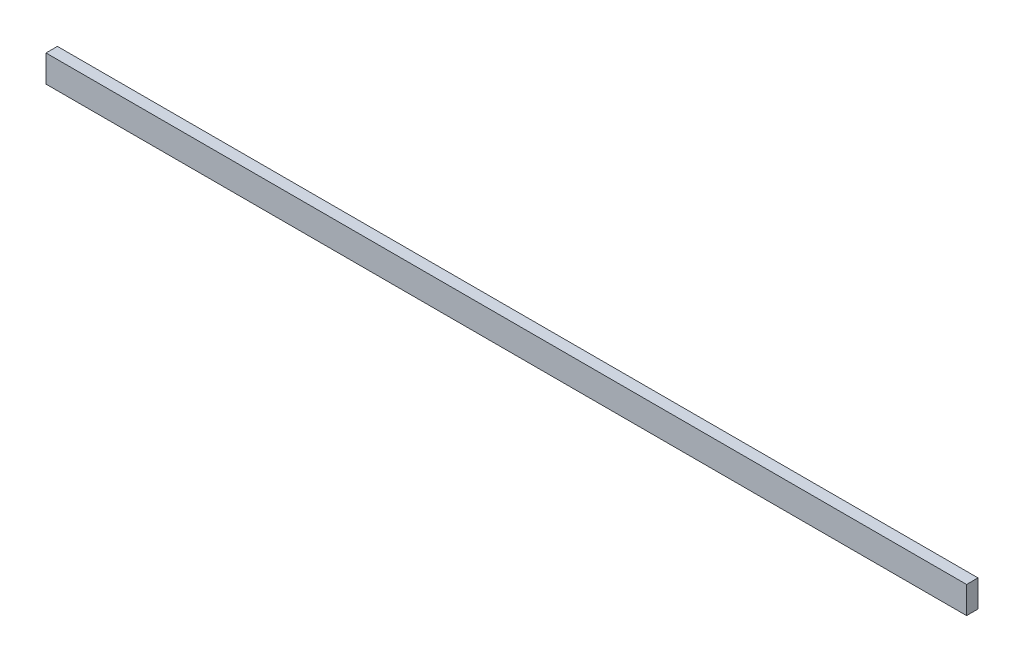
from build123d import *

# Parameters (mm, degrees)
SKETCH1_W           = 1533.9
SKETCH1_H           = 19
BOSS_EXTRUDE1_DEPTH = 45


with BuildPart() as part:
    # Sketch1 → Boss-Extrude1 (new body)
    with BuildSketch(Plane(origin=(0, 0, 0), x_dir=(1, 0, 0), z_dir=(0, 1, 0))):
        with Locations((766.95, 0)):
            Rectangle(SKETCH1_W, SKETCH1_H)
    extrude(amount=BOSS_EXTRUDE1_DEPTH)


solid = part.part
